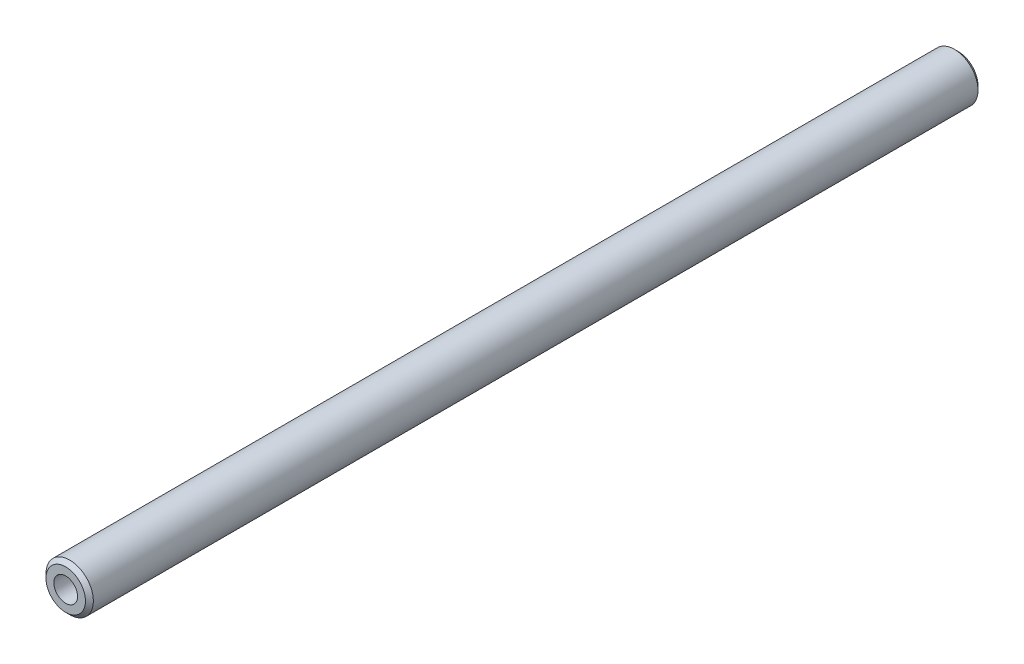
from build123d import *

# Parameters (mm, degrees)
SKETCH_1_R      = 6
SKETCH_1_R_2    = 3
EXTRUDE_1_DEPTH = 226
CHAMFER_1_SIZE  = 1


with BuildPart() as part:
    # 草图1 → 凸台-拉伸1 (new body)
    with BuildSketch(Plane.XY):
        Circle(SKETCH_1_R)
        Circle(SKETCH_1_R_2, mode=Mode.SUBTRACT)
    extrude(amount=EXTRUDE_1_DEPTH)

    # 倒角1
    chamfer_1_edges = [part.edges().sort_by_distance(p)[0] for p in [
        (-6, 0, 0),
        (-6, 0, 226),
    ]]
    chamfer(chamfer_1_edges, length=CHAMFER_1_SIZE)


solid = part.part
